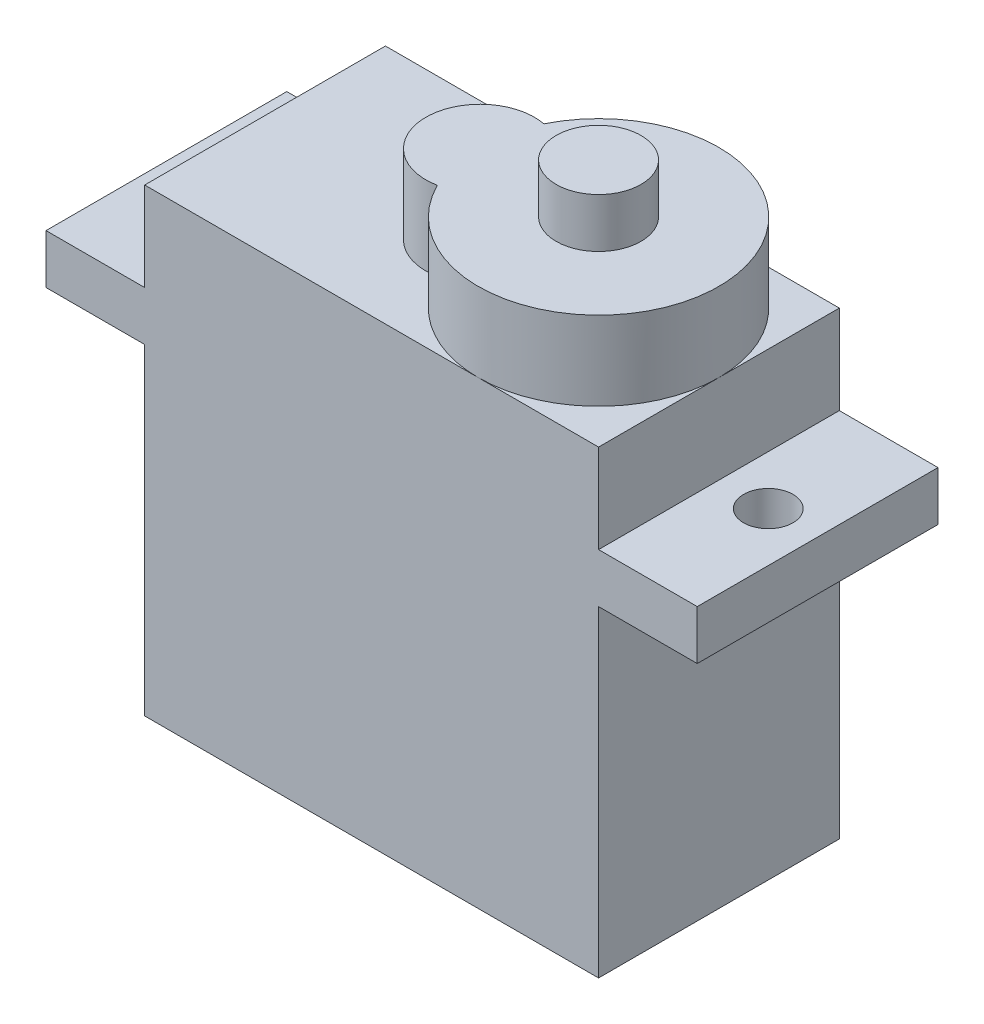
from build123d import *

# Parameters (mm, degrees)
SKETCH1_W           = 23
SKETCH1_H           = 12.2
BOSS_EXTRUDE1_DEPTH = 23.3
BOSS_EXTRUDE2_START = -4.5
SKETCH2_W           = 5
SKETCH2_H           = 12.2
SKETCH2_R           = 1.25
BOSS_EXTRUDE2_DEPTH = 2.5
SKETCH3_R           = 2.15
BOSS_EXTRUDE3_DEPTH = 4
BOSS_EXTRUDE4_START = 4
SKETCH3_4_R         = 2.15
BOSS_EXTRUDE4_DEPTH = 2.5


with BuildPart() as part:
    # Sketch1 → Boss-Extrude1 (new body)
    with BuildSketch(Plane(origin=(0, 0, 0), x_dir=(1, 0, 0), z_dir=(0, 1, 0))):
        Rectangle(SKETCH1_W, SKETCH1_H)
    extrude(amount=BOSS_EXTRUDE1_DEPTH)

    # Sketch2 → Boss-Extrude2 (add)
    # profile 1 of 2: a face of its own
    with BuildSketch(Plane(origin=(0, 23.3, 0), x_dir=(1, 0, 0), z_dir=(0, 1, 0)).offset(BOSS_EXTRUDE2_START)):
        with Locations((-14, 0)):
            Rectangle(SKETCH2_W, SKETCH2_H)
        with Locations(Location((-14, 0, 0), (0, 0, 270))):
            Circle(SKETCH2_R, mode=Mode.SUBTRACT)
    # profile 2 of 2: a face of its own
    with BuildSketch(Plane(origin=(0, 23.3, 0), x_dir=(1, 0, 0), z_dir=(0, 1, 0)).offset(BOSS_EXTRUDE2_START)):
        with Locations((14, 0)):
            Rectangle(SKETCH2_W, SKETCH2_H)
        with Locations(Location((14, 0, 0), (0, 0, 90))):
            Circle(SKETCH2_R, mode=Mode.SUBTRACT)
    extrude(amount=-BOSS_EXTRUDE2_DEPTH)

    # Sketch3 → Boss-Extrude3 (add)
    # profile 1 of 2: a face of its own
    with BuildSketch(Plane(origin=(0, 23.3, 0), x_dir=(1, 0, 0), z_dir=(0, 1, 0))):
        with BuildLine():
            ThreePointArc((-0.070625, -2.698566677), (11.5, 0), (-0.070625, 2.698566677))
            ThreePointArc((-0.070625, 2.698566677), (-3.35, 0), (-0.070625, -2.698566677))
        make_face()
        with Locations((5.4, 0)):
            Circle(SKETCH3_R, mode=Mode.SUBTRACT)
    # profile 2 of 2: a face of its own
    with BuildSketch(Plane(origin=(0, 23.3, 0), x_dir=(1, 0, 0), z_dir=(0, 1, 0))):
        with Locations((5.4, 0)):
            Circle(SKETCH3_R)
    extrude(amount=BOSS_EXTRUDE3_DEPTH)

    # Sketch3<4> → Boss-Extrude4 (add)
    with BuildSketch(Plane(origin=(0, 23.3, 0), x_dir=(1, 0, 0), z_dir=(0, 1, 0)).offset(BOSS_EXTRUDE4_START)):
        with Locations(Location((5.4, 0, 0), (0, 0, 270))):
            Circle(SKETCH3_4_R)
    extrude(amount=BOSS_EXTRUDE4_DEPTH)


solid = part.part
